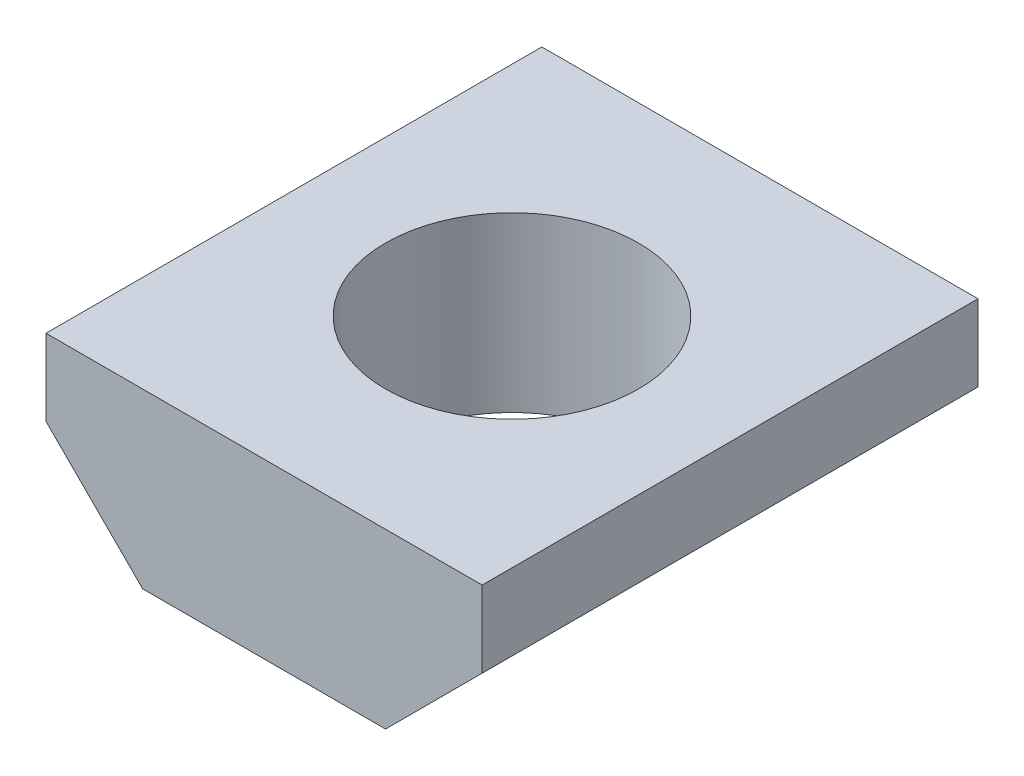
from build123d import *

# Parameters (mm, degrees)
BOSS_EXTRUDE1_DEPTH         = 12.446
F_1_4_0_25_DIAMETER_HOLE1_D = 6.35


with BuildPart() as part:
    # Sketch1 → Boss-Extrude1 (new body)
    with BuildSketch(Plane.XY):
        Polygon((-5.4737, 0), (5.4737, 0), (5.4737, -1.9177), (3.048, -4.3434), (-3.048, -4.3434), (-5.4737, -1.9177), align=None)
    extrude(amount=BOSS_EXTRUDE1_DEPTH)

    # 1/4 (0.25) Diameter Hole1 (through all)
    with Locations(Plane(origin=(0, 0, 0), x_dir=(1, 0, 0), z_dir=(0, 1, 0))):
        with Locations((0, -6.223)):
            Hole(F_1_4_0_25_DIAMETER_HOLE1_D / 2)


solid = part.part
